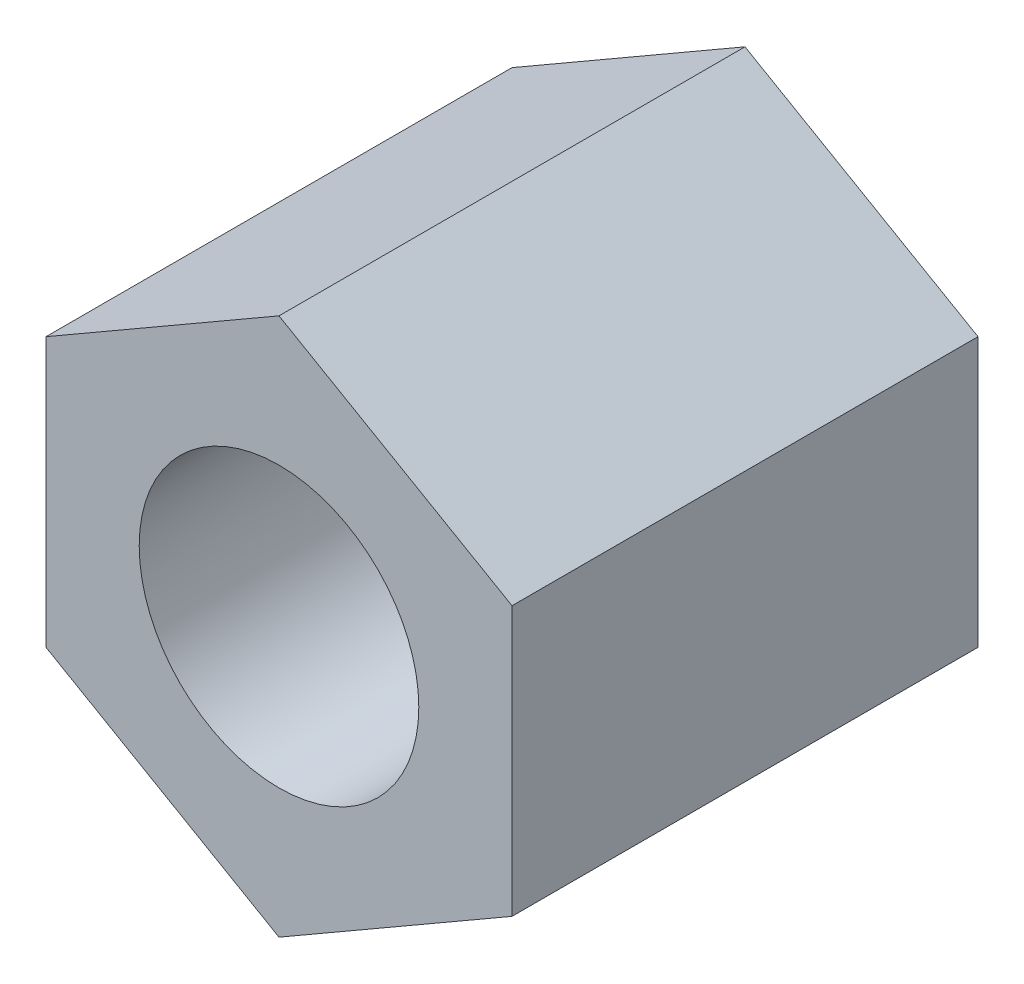
from build123d import *

# Parameters (mm, degrees)
SKETCH_1_R      = 1.5
EXTRUDE_1_DEPTH = 5


with BuildPart() as part:
    # ｽｹｯﾁ1 → ﾎﾞｽ - 押し出し1 (new body)
    with BuildSketch(Plane.XY):
        Polygon((0, -2.886751346), (2.5, -1.443375673), (2.5, 1.443375673), (0, 2.886751346), (-2.5, 1.443375673), (-2.5, -1.443375673), align=None)
        Circle(SKETCH_1_R, mode=Mode.SUBTRACT)
    extrude(amount=EXTRUDE_1_DEPTH)


solid = part.part
